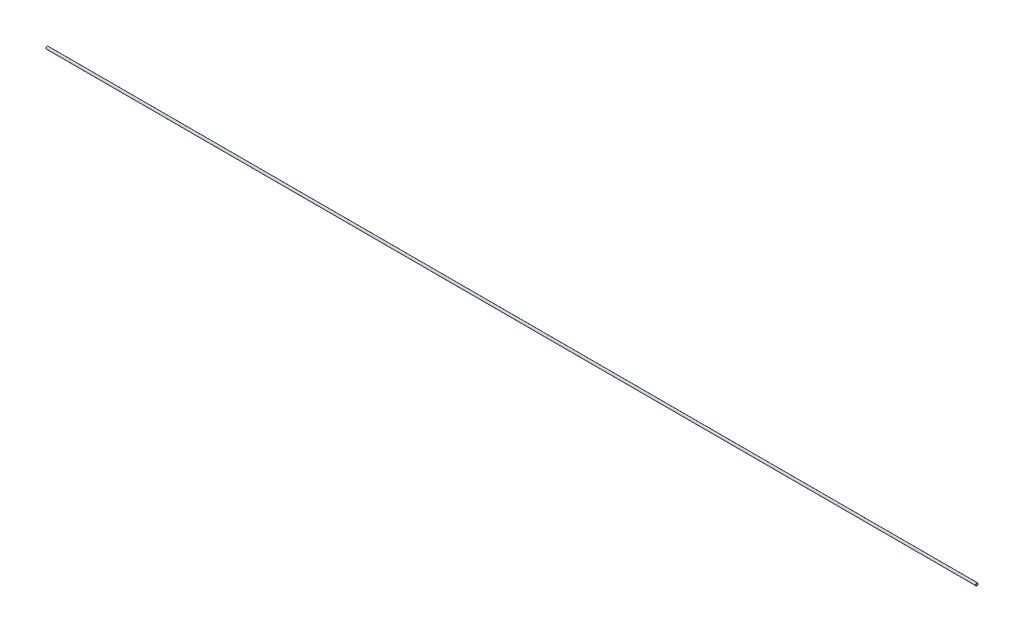
from build123d import *

# Parameters (mm, degrees)
SKETCH10_R          = 0.79375
BOSS_EXTRUDE3_DEPTH = 300.4
CHAMFER1_SIZE       = 0.15875


with BuildPart() as part:
    # Sketch10 → Boss-Extrude3 (new, symmetric)
    with BuildSketch(Plane(origin=(0, 0, 0), x_dir=(0, 0, -1), z_dir=(1, 0, 0))):
        Circle(SKETCH10_R)
    extrude(amount=BOSS_EXTRUDE3_DEPTH, both=True)

    # Chamfer1
    chamfer1_edges = [part.edges().sort_by_distance(p)[0] for p in [
        (-300.4, 0, 0.79375),
        (300.4, 0, 0.79375),
    ]]
    chamfer(chamfer1_edges, length=CHAMFER1_SIZE)


solid = part.part
